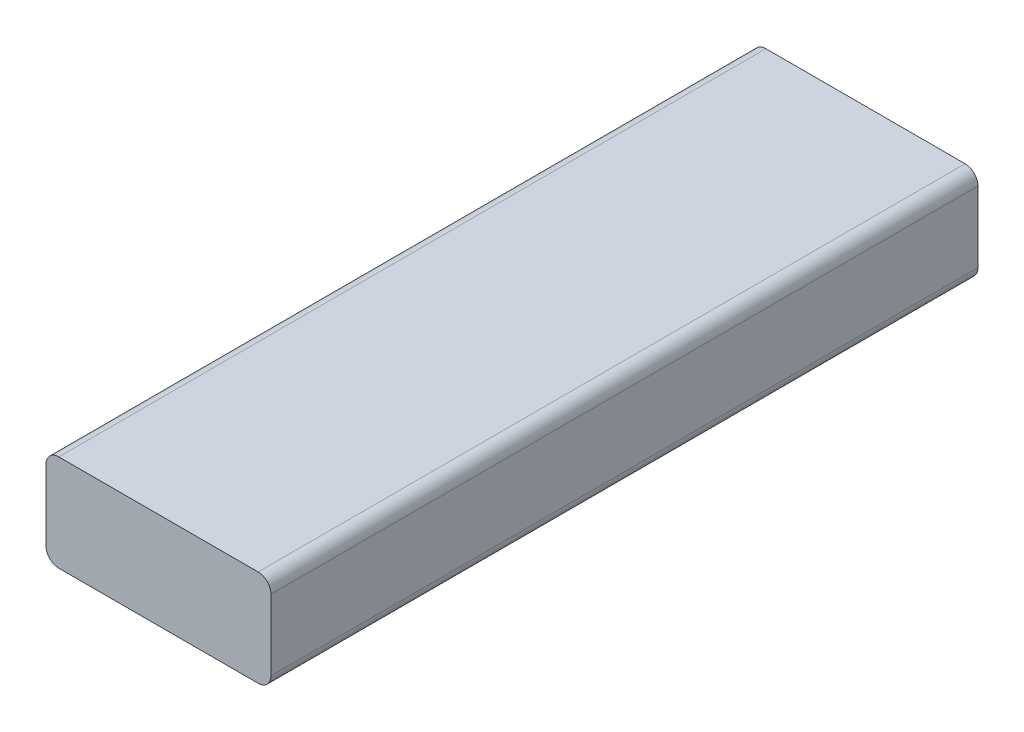
from build123d import *

# Parameters (mm, degrees)
SKETCH1_W           = 88.9
SKETCH1_H           = 38.1
BOSS_EXTRUDE1_DEPTH = 279.4
FILLET1_R           = 5.08


with BuildPart() as part:
    # Sketch1 → Boss-Extrude1 (new body)
    with BuildSketch(Plane.XY):
        with Locations((44.45, 19.05)):
            Rectangle(SKETCH1_W, SKETCH1_H)
    extrude(amount=BOSS_EXTRUDE1_DEPTH)

    # Fillet1
    fillet1_edges = [part.edges().sort_by_distance(p)[0] for p in [
        (0, 38.1, 139.7),
        (88.9, 38.1, 139.7),
        (88.9, 0, 139.7),
        (0, 0, 139.7),
    ]]
    fillet(fillet1_edges, radius=FILLET1_R)


solid = part.part
